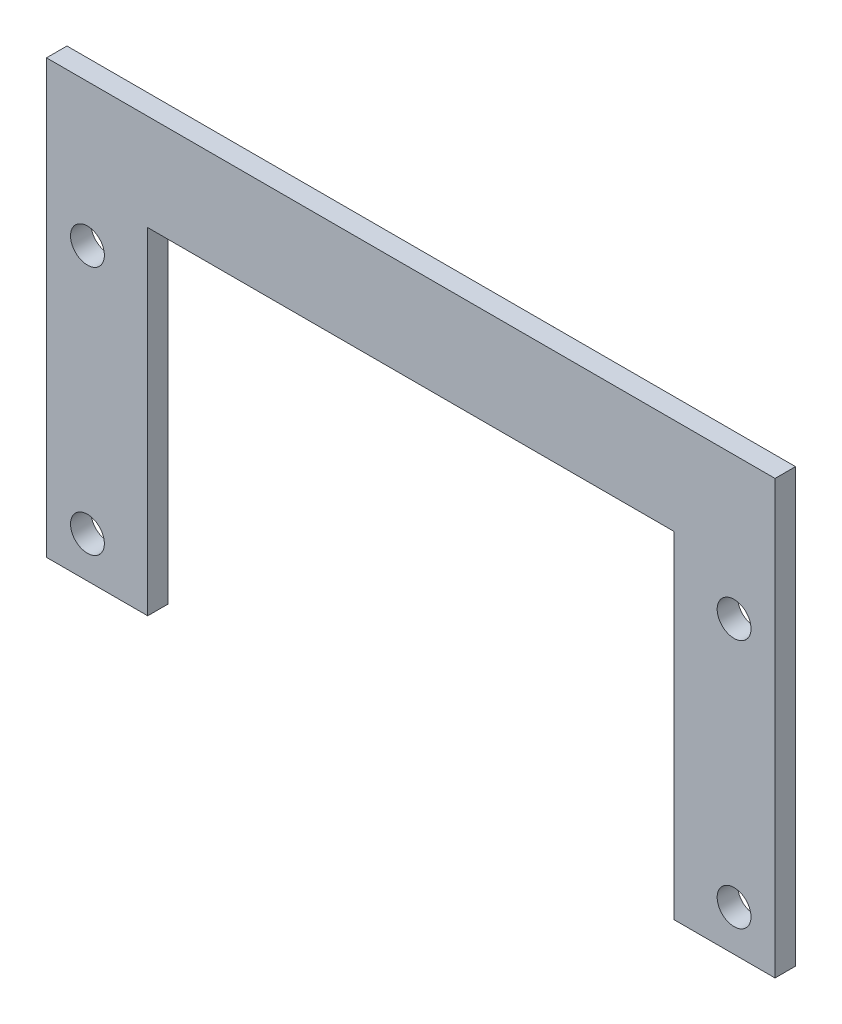
from build123d import *

# Parameters (mm, degrees)
SKETCH1_R           = 2.625
BOSS_EXTRUDE1_DEPTH = 3.175


with BuildPart() as part:
    # Sketch1 → Boss-Extrude1 (new body)
    with BuildSketch(Plane.XY):
        Polygon((-8.910000095, 8.69), (6.789999905, 8.69), (6.789999905, 60.853549492), (88.409998474, 60.853549492), (88.409998474, 8.69), (104.109998474, 8.69), (104.109998474, 75.81), (88.409998474, 75.81), (6.789999905, 75.81), (-8.910000095, 75.81), align=None)
        with Locations((-2.560000095, 53.76)):
            Circle(SKETCH1_R, mode=Mode.SUBTRACT)
        with Locations((-2.560000095, 15.04)):
            Circle(SKETCH1_R, mode=Mode.SUBTRACT)
        with Locations((97.759998474, 15.04)):
            Circle(SKETCH1_R, mode=Mode.SUBTRACT)
        with Locations((97.759998474, 53.76)):
            Circle(SKETCH1_R, mode=Mode.SUBTRACT)
    extrude(amount=BOSS_EXTRUDE1_DEPTH)


solid = part.part
